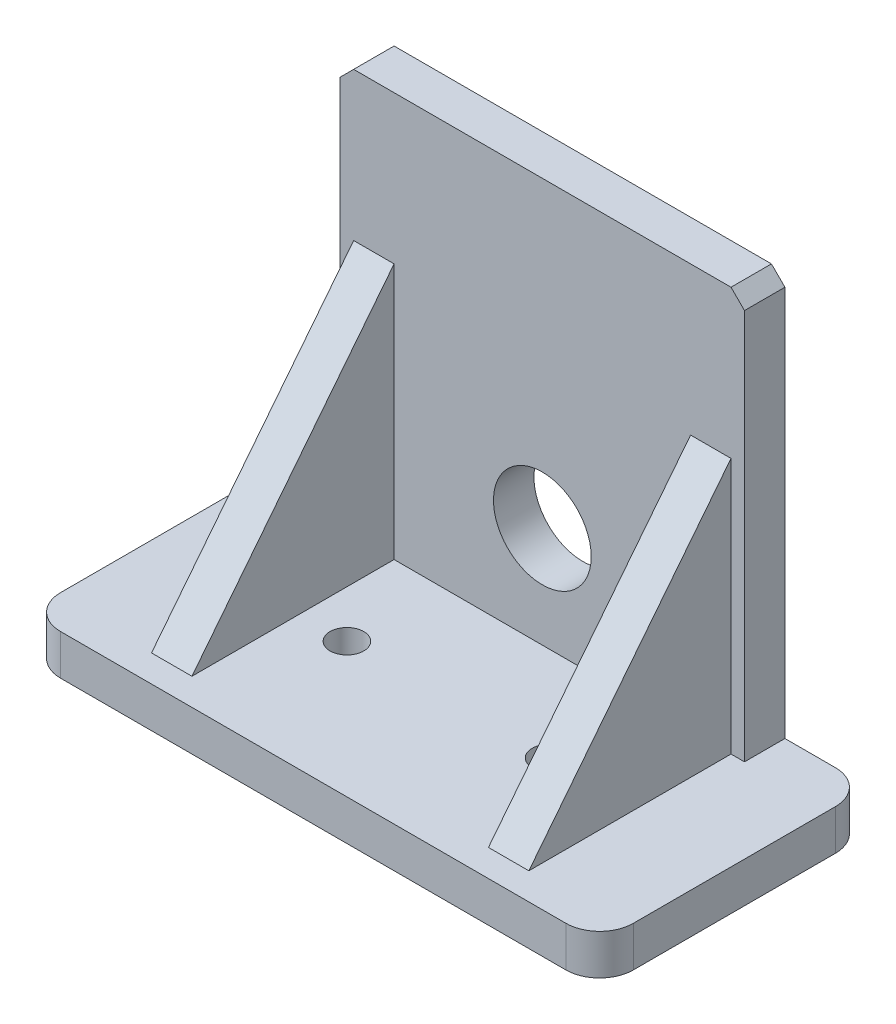
from build123d import *

# Parameters (mm, degrees)
SKETCH1_R           = 2.5
BOSS_EXTRUDE1_DEPTH = 6
BOSS_EXTRUDE2_START = -12.5
SKETCH2_W           = 6
SKETCH2_H           = 60
BOSS_EXTRUDE2_DEPTH = 60
BOSS_EXTRUDE3_START = -2
BOSS_EXTRUDE3_DEPTH = 6
BOSS_EXTRUDE4_START = -2
BOSS_EXTRUDE4_DEPTH = 6
SKETCH6_R           = 7.25
CUT_EXTRUDE1_DEPTH  = 86.546770833
CHAMFER3_SIZE       = 2


with BuildPart() as part:
    # Sketch1 → Boss-Extrude1 (new body)
    with BuildSketch(Plane(origin=(0, 0, 0), x_dir=(1, 0, 0), z_dir=(0, 1, 0))):
        with BuildLine():
            Line((-37.5, -20), (37.5, -20))
            ThreePointArc((37.5, -20), (41.035533906, -18.535533906), (42.5, -15))
            Line((42.5, -15), (42.5, 15))
            ThreePointArc((42.5, 15), (41.035533906, 18.535533906), (37.5, 20))
            Line((37.5, 20), (-37.5, 20))
            ThreePointArc((-37.5, 20), (-41.035533906, 18.535533906), (-42.5, 15))
            Line((-42.5, 15), (-42.5, -15))
            ThreePointArc((-42.5, -15), (-41.035533906, -18.535533906), (-37.5, -20))
        make_face()
        with Locations(Location((-15, 0, 0), (0, 0, 270))):
            Circle(SKETCH1_R, mode=Mode.SUBTRACT)
        with Locations(Location((15, 0, 0), (0, 0, 270))):
            Circle(SKETCH1_R, mode=Mode.SUBTRACT)
    extrude(amount=BOSS_EXTRUDE1_DEPTH)

    # Sketch2 → Boss-Extrude2 (add)
    with BuildSketch(Plane.ZY.offset(42.5).offset(BOSS_EXTRUDE2_START)):
        with Locations((-17, 36)):
            Rectangle(SKETCH2_W, SKETCH2_H)
    extrude(amount=-BOSS_EXTRUDE2_DEPTH)

    # Sketch4 → Boss-Extrude3 (add)
    with BuildSketch(Plane.ZY.offset(30).offset(BOSS_EXTRUDE3_START)):
        Polygon((16, 6), (-14, 44), (-14, 6), align=None)
    extrude(amount=-BOSS_EXTRUDE3_DEPTH)

    # Sketch5 → Boss-Extrude4 (add)
    with BuildSketch(Plane(origin=(30, 0, 0), x_dir=(0, 0, -1), z_dir=(1, 0, 0)).offset(BOSS_EXTRUDE4_START)):
        Polygon((-16, 6), (14, 44), (14, 6), align=None)
    extrude(amount=-BOSS_EXTRUDE4_DEPTH)

    # Sketch6 → Cut-Extrude1 (cut, through all)
    with BuildSketch(Plane.XY.offset(-14)):
        with Locations((0, 21)):
            Circle(SKETCH6_R)
    extrude(amount=-CUT_EXTRUDE1_DEPTH, mode=Mode.SUBTRACT)

    # Chamfer3
    chamfer3_edges = [part.edges().sort_by_distance(p)[0] for p in [
        (30, 66, -17),
        (-30, 66, -17),
    ]]
    chamfer(chamfer3_edges, length=CHAMFER3_SIZE)


solid = part.part
